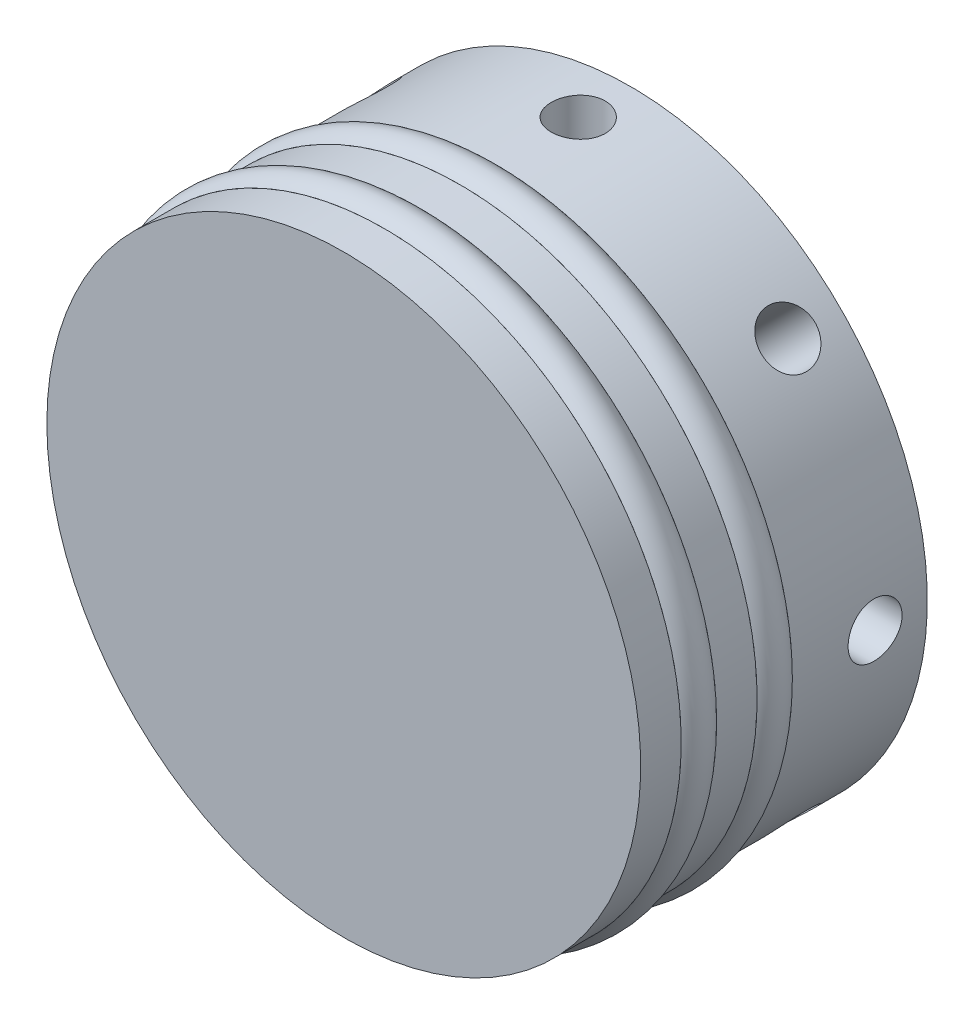
from build123d import *

# Parameters (mm, degrees)
ESBO_O3_R             = 2
CORTE_EXTRUS_O1_DEPTH = 8
PADR_OCIRCULAR1_COUNT = 8


with BuildPart() as part:
    # Esboço2 → Revolução1 (revolve)
    with BuildSketch(Plane(origin=(0, 0, 0), x_dir=(1, 0, 0), z_dir=(0, 1, 0))):
        Polygon((-14.791423404, 14.965597198), (-22, 14.965597198), (-22, 4.965597198), (-20, 4.965597198), (-20, 2.345597198), (-22, 2.345597198), (-22, -0.654402802), (-20, -0.654402802), (-20, -3.274402802), (-22, -3.274402802), (-22, -6.274402802), (0, -6.274402802), (0, -0.654402802), (0, 7.225597198), (-14.791423404, 7.225597198), align=None)
    revolve(axis=Axis((0, 0, -1026.34324457), (0, 0, 1)))

    # Esboço3 → Corte-extrusão1 (cut)
    with BuildSketch(Plane(origin=(0, 22, 0), x_dir=(1, 0, 0), z_dir=(0, 1, 0))):
        with Locations((0, 11.095597198)):
            Circle(ESBO_O3_R)
    corte_extrus_o1 = extrude(amount=-CORTE_EXTRUS_O1_DEPTH, mode=Mode.SUBTRACT)

    # PadrãoCircular1: Corte-extrusão1 ×8 about axis
    padr_ocircular1_axis = Axis((0, 0, -14.965597198), (0, 0, -1))
    for i in range(1, PADR_OCIRCULAR1_COUNT):
        add(corte_extrus_o1.rotate(padr_ocircular1_axis, i * 360 / PADR_OCIRCULAR1_COUNT), mode=Mode.SUBTRACT)


with BuildPart() as body_2:
    # Esboço6 → Revolução3 (revolve)
    with BuildSketch(Plane(origin=(0, 0, 0), x_dir=(1, 0, 0), z_dir=(0, 1, 0))):
        with BuildLine():
            Line((22, 4.965597198), (20, 4.965597198))
            Line((20, 4.965597198), (20, 2.345597198))
            Line((20, 2.345597198), (22, 2.345597198))
            ThreePointArc((22, 2.345597198), (22.542619767, 3.655597198), (22, 4.965597198))
        make_face()
        with BuildLine():
            Line((20, -3.274402802), (20, -0.654402802))
            Line((20, -0.654402802), (22, -0.654402802))
            ThreePointArc((22, -0.654402802), (22.542619767, -1.964402802), (22, -3.274402802))
            Line((22, -3.274402802), (20, -3.274402802))
        make_face()
    revolve(axis=Axis((0, 0, 0), (0, 0, -1)))


solid = Compound([part.part, body_2.part])
